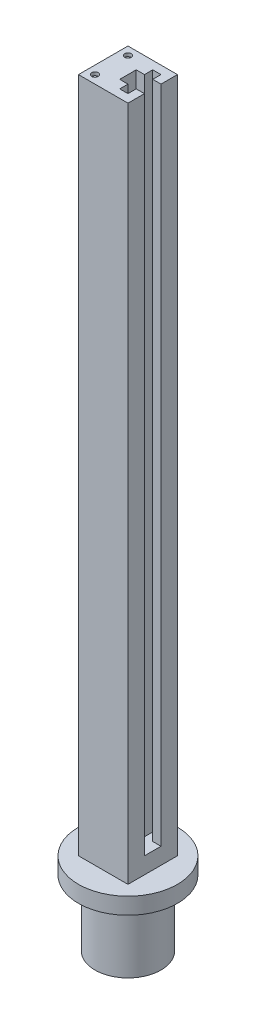
from build123d import *

# Parameters (mm, degrees)
SKETCH5_W           = 150
SKETCH5_H           = 150
BOSS_EXTRUDE1_DEPTH = 2050
CUT_EXTRUDE1_DEPTH  = 2000
SKETCH8_R           = 10
CUT_EXTRUDE2_DEPTH  = 10


with BuildPart() as part:
    # Sketch4 → Revolve1 (revolve)
    with BuildSketch(Plane.XY):
        Polygon((0, 101.851851852), (0, -148.148148148), (100, -148.148148148), (100, 51.851851852), (150, 51.851851852), (150, 101.851851852), align=None)
    revolve(axis=Axis((0, 101.851851852, 0), (0, -1, 0)))

    # Sketch5 → Boss-Extrude1 (add)
    with BuildSketch(Plane(origin=(0, 101.851851852, 0), x_dir=(1, 0, 0), z_dir=(0, 1, 0))):
        Rectangle(SKETCH5_W, SKETCH5_H)
    extrude(amount=BOSS_EXTRUDE1_DEPTH)

    # Sketch6 → Cut-Extrude1 (cut)
    with BuildSketch(Plane(origin=(0, 2151.851851852, 0), x_dir=(1, 0, 0), z_dir=(0, 1, 0))):
        Polygon((0, 0), (0, 25), (25, 25), (25, 50), (50, 50), (50, 25), (75, 25), (75, -25), (50, -25), (50, -50), (25, -50), (25, -25), (0, -25), align=None)
    extrude(amount=-CUT_EXTRUDE1_DEPTH, mode=Mode.SUBTRACT)

    # Sketch8 → Cut-Extrude2 (cut)
    with BuildSketch(Plane(origin=(0, 2151.851851852, 0), x_dir=(1, 0, 0), z_dir=(0, 1, 0))):
        with Locations((-50, 50)):
            Circle(SKETCH8_R)
        with Locations((-50, -50)):
            Circle(SKETCH8_R)
    extrude(amount=-CUT_EXTRUDE2_DEPTH, mode=Mode.SUBTRACT)


solid = part.part
